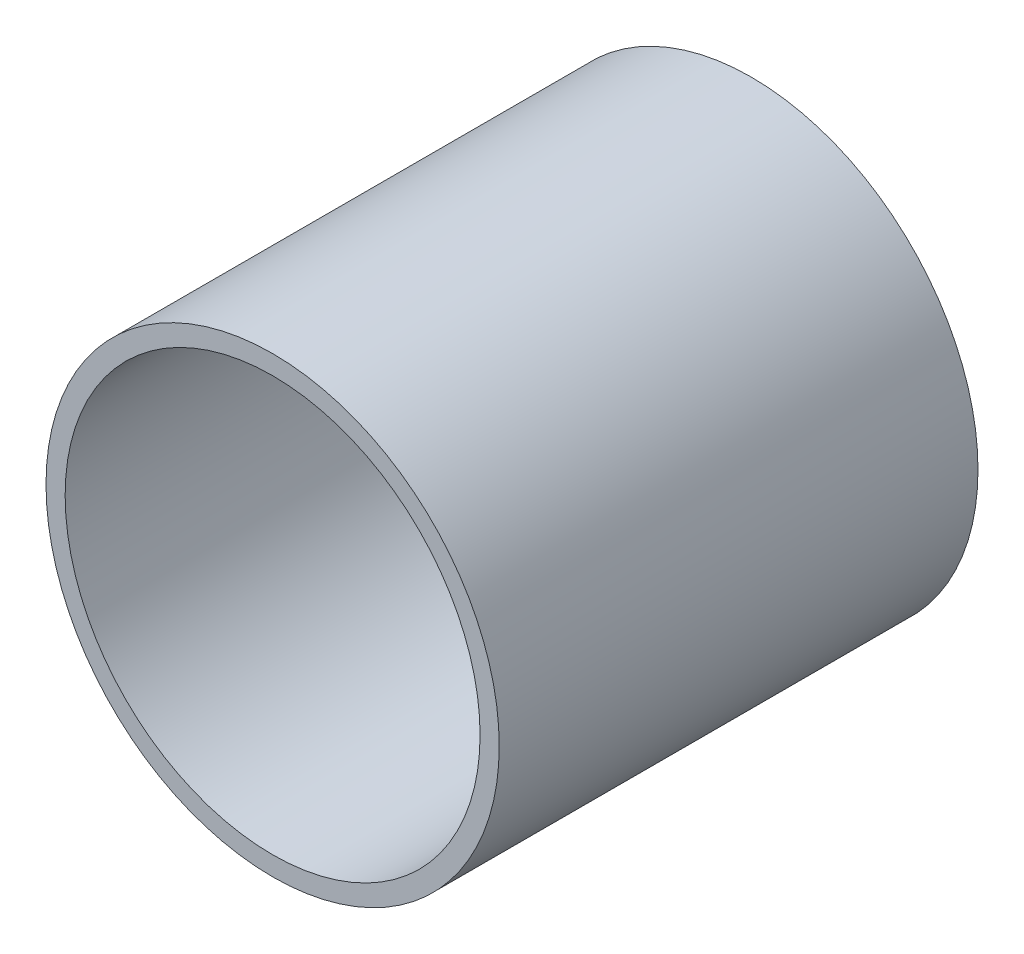
from build123d import *

# Parameters (mm, degrees)
ESQUISSE1_R        = 35.5
ESQUISSE1_R_2      = 32.5
BOSS_EXTRU_1_DEPTH = 75


with BuildPart() as part:
    # Esquisse1 → Boss.-Extru.1 (new body)
    with BuildSketch(Plane.XY):
        Circle(ESQUISSE1_R)
        Circle(ESQUISSE1_R_2, mode=Mode.SUBTRACT)
    extrude(amount=BOSS_EXTRU_1_DEPTH)


solid = part.part
